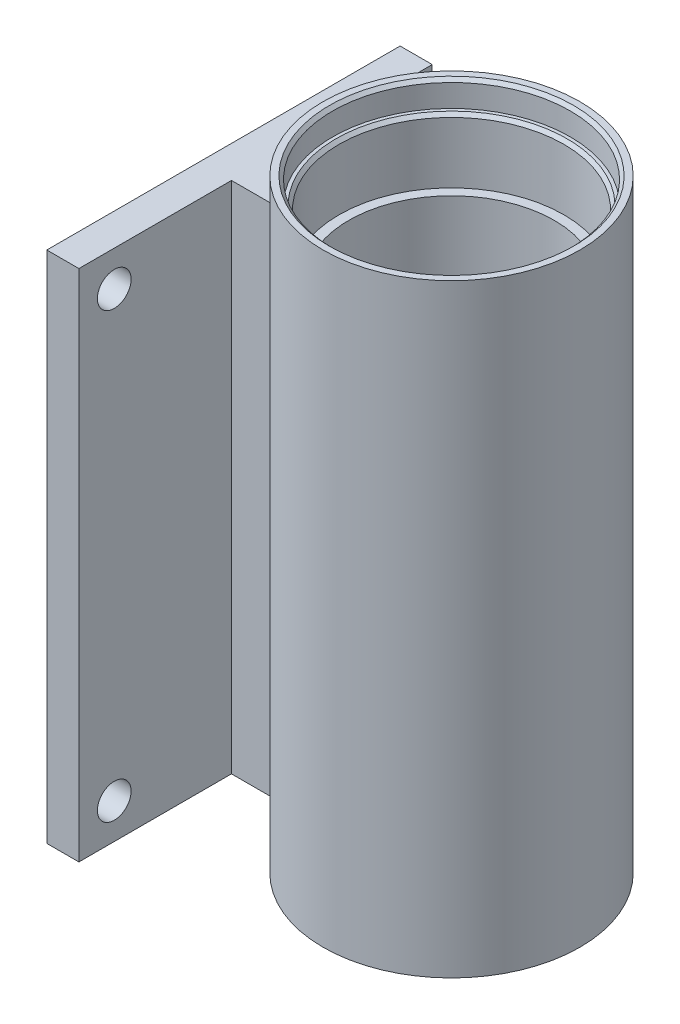
from build123d import *

# Parameters (mm, degrees)
SCHIZZO1_R        = 32
ESTRUSIONE1_DEPTH = 160
SCHIZZO2_R        = 40
SCHIZZO2_R_2      = 35
ESTRUSIONE2_DEPTH = 20
SCHIZZO4_R        = 5.25
ESTRUSIONE4_DEPTH = 20
SCHIZZO5_R        = 4
ESTRUSIONE5_DEPTH = 12
SCHIZZO6_R        = 40
SCHIZZO6_R_2      = 37
ESTRUSIONE6_DEPTH = 8
SCHIZZO7_R        = 35
ESTRUSIONE7_DEPTH = 20
SMUSSO1_SIZE      = 1


with BuildPart() as part:
    # Schizzo1 → Estrusione1 (new body)
    with BuildSketch(Plane(origin=(0, 0, 0), x_dir=(1, 0, 0), z_dir=(0, 1, 0))):
        with BuildLine():
            Line((-39.290584114, 7.5), (-61, 7.5))
            Line((-61, 7.5), (-61, 55))
            Line((-61, 55), (-71, 55))
            Line((-71, 55), (-71, -55))
            Line((-71, -55), (-61, -55))
            Line((-61, -55), (-61, -7.5))
            Line((-61, -7.5), (-39.290584114, -7.5))
            ThreePointArc((-39.290584114, -7.5), (40, 0), (-39.290584114, 7.5))
        make_face()
        with Locations(Location((0, 0, 0), (0, 0, 270))):
            Circle(SCHIZZO1_R, mode=Mode.SUBTRACT)
    extrude(amount=ESTRUSIONE1_DEPTH)

    # Schizzo2 → Estrusione2 (add)
    with BuildSketch(Plane(origin=(0, 160, 0), x_dir=(1, 0, 0), z_dir=(0, 1, 0))):
        with Locations(Location((0, 0, 0), (0, 0, 169.193077125))):
            Circle(SCHIZZO2_R)
        with Locations(Location((0, 0, 0), (0, 0, 270))):
            Circle(SCHIZZO2_R_2, mode=Mode.SUBTRACT)
    extrude(amount=ESTRUSIONE2_DEPTH)

    # Schizzo4 → Estrusione4 (cut)
    with BuildSketch(Plane.ZY.offset(71)):
        with Locations((-44, 149)):
            Circle(SCHIZZO4_R)
        with Locations((44, 149)):
            Circle(SCHIZZO4_R)
        with Locations((44, 11)):
            Circle(SCHIZZO4_R)
        with Locations((-44, 11)):
            Circle(SCHIZZO4_R)
    extrude(amount=-ESTRUSIONE4_DEPTH, mode=Mode.SUBTRACT)

    # Schizzo5 → Estrusione5 (cut)
    with BuildSketch(Plane.ZY.offset(71)):
        with Locations((0, 149)):
            Circle(SCHIZZO5_R)
        with Locations(Location((0, 11, 0), (0, 0, 180))):
            Circle(SCHIZZO5_R)
    extrude(amount=-ESTRUSIONE5_DEPTH, mode=Mode.SUBTRACT)

    # Schizzo6 → Estrusione6 (add)
    with BuildSketch(Plane(origin=(0, 180, 0), x_dir=(1, 0, 0), z_dir=(0, 1, 0))):
        with Locations(Location((0, 0, 0), (0, 0, 169.193077125))):
            Circle(SCHIZZO6_R)
        with Locations(Location((0, 0, 0), (0, 0, 270))):
            Circle(SCHIZZO6_R_2, mode=Mode.SUBTRACT)
    extrude(amount=ESTRUSIONE6_DEPTH)

    # Schizzo7 → Estrusione7 (cut)
    with BuildSketch(Plane.XZ):
        with Locations(Location((0, 0, 0), (0, 0, 90))):
            Circle(SCHIZZO7_R)
    extrude(amount=-ESTRUSIONE7_DEPTH, mode=Mode.SUBTRACT)

    # Smusso1
    smusso1_edges = [part.edges().sort_by_distance(p)[0] for p in [
        (0, 180, -35),
        (0, 188, -37),
        (0, 0, -35),
    ]]
    chamfer(smusso1_edges, length=SMUSSO1_SIZE)


solid = part.part
